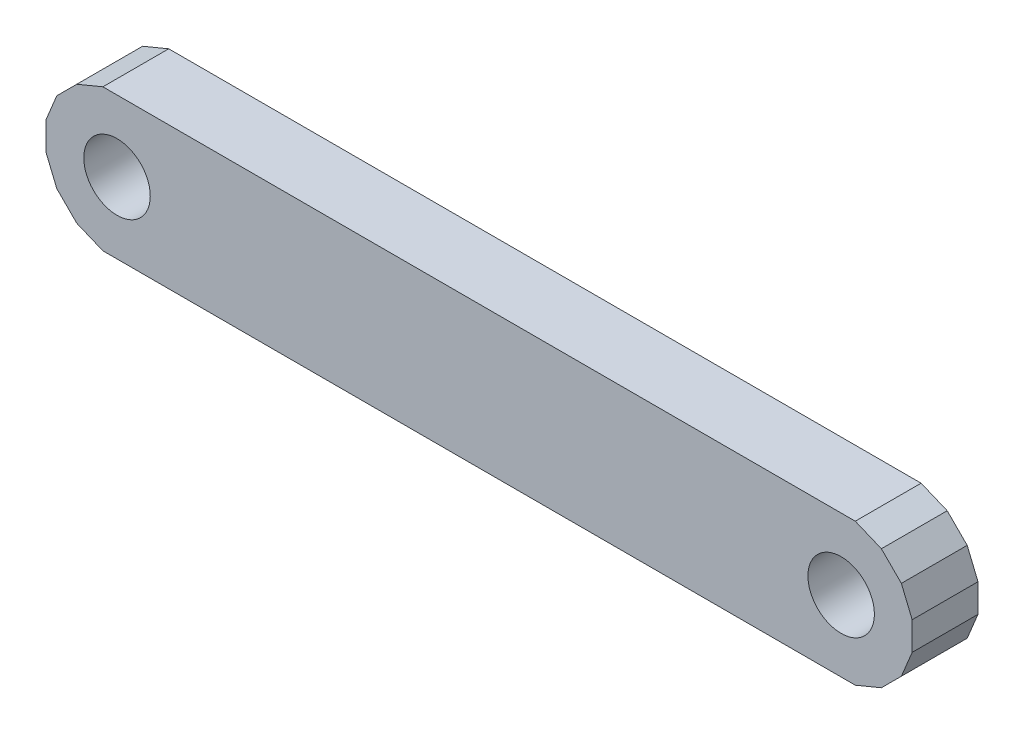
from build123d import *

# Parameters (mm, degrees)
PASSIVE_ARM_START = 8
PROFILE_1_R       = 5.05
PASSIVE_ARM_DEPTH = 10


with BuildPart() as part:
    # Profile_1 → Passive_arm (new body)
    with BuildSketch(Plane.XY.offset(PASSIVE_ARM_START)):
        Polygon((-10.788638084, 2.145993542), (-10.788638084, -2.145993542), (-9.146165735, -6.111272563), (-6.111272563, -9.146165735), (-2.145993542, -10.788638084), (112.145993542, -10.788638084), (116.111272563, -9.146165735), (119.146165735, -6.111272563), (120.788638084, -2.145993542), (120.788638084, 2.145993542), (119.146165735, 6.111272563), (116.111272563, 9.146165735), (112.145993542, 10.788638084), (-2.145993542, 10.788638084), (-6.111272563, 9.146165735), (-9.146165735, 6.111272563), align=None)
        Circle(PROFILE_1_R, mode=Mode.SUBTRACT)
        with Locations((110, 0)):
            Circle(PROFILE_1_R, mode=Mode.SUBTRACT)
    extrude(amount=PASSIVE_ARM_DEPTH)


solid = part.part
